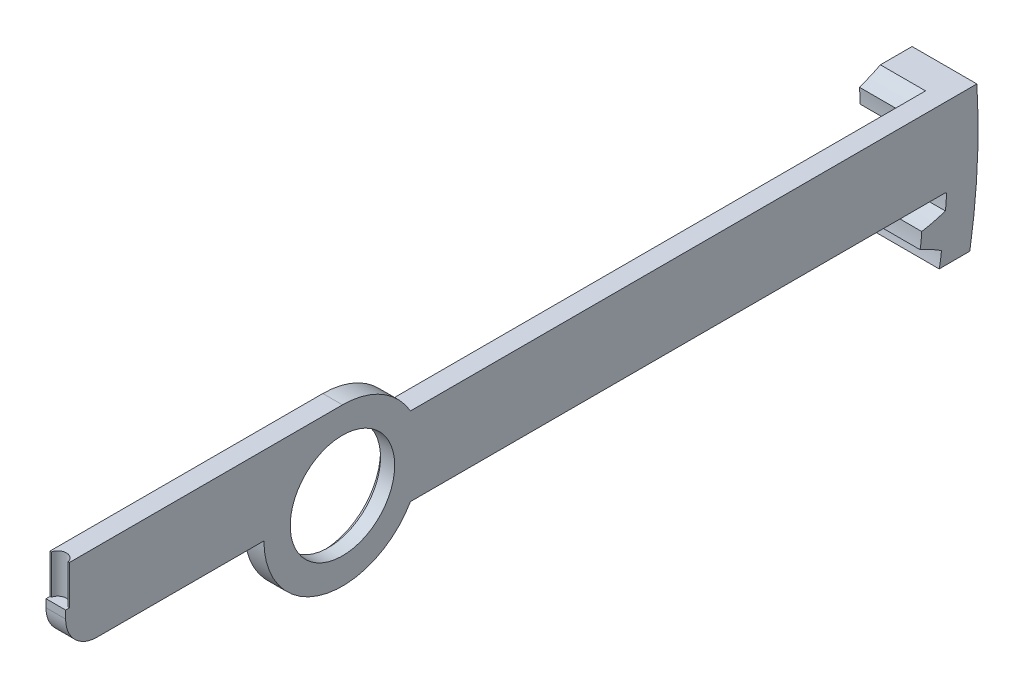
from build123d import *

# Parameters (mm, degrees)
SKETCH_1_R              = 6.65
EXTRUDE_1_DEPTH         = 1.25
EXTRUDE_2_DEPTH         = 1.25
EXTRUDE_2_DEPTH_BACK    = 7
SKETCH_3_R              = 1.1
CUT_EXTRUDE_1_DEPTH     = 5
CHAMFER_1_SIZE          = 0.7
CUT_EXTRUDE1_DEPTH      = 10
CUT_EXTRUDE1_DEPTH_BACK = 10
SKETCH1_W               = 17.169793681
SKETCH1_H               = 8.928336681


with BuildPart() as part:
    # Эскиз1 → Бобышка-Вытянуть1 (new, symmetric)
    with BuildSketch(Plane(origin=(0, 0, 0), x_dir=(0, 0, -1), z_dir=(1, 0, 0))):
        with BuildLine():
            Line((-31.25, 0), (-10, 0))
            ThreePointArc((-10, 0), (-2.588190451, -9.659258263), (8.660254038, -5))
            Line((8.660254038, -5), (76.721847542, -5))
            ThreePointArc((76.721847542, -5), (75.425886146, -4.389181279), (74.09117429, -3.868451302))
            ThreePointArc((74.09117429, -3.868451302), (74.147561595, -2.912548148), (74.149130868, -1.954984622))
            ThreePointArc((74.149130868, -1.954984622), (75.638846987, -1.51744657), (77.087831178, -0.959648686))
            ThreePointArc((77.087831178, -0.959648686), (77.109856091, -0.006099484), (77.083941958, 0.947351948))
            ThreePointArc((77.083941958, 0.947351948), (75.643750299, 1.505844774), (74.166291118, 1.956600379))
            ThreePointArc((74.166291118, 1.956600379), (74.147505302, 2.913980899), (74.073940169, 3.8687157))
            ThreePointArc((74.073940169, 3.8687157), (75.433826566, 4.383081961), (76.750365892, 5))
            Line((76.750365892, 5), (8.660254038, 5))
            ThreePointArc((8.660254038, 5), (5, 8.660254038), (0, 10))
            Line((0, 10), (-34.75, 10))
            Line((-34.75, 10), (-34.75, 5))
            Line((-34.75, 5), (-35.25, 5))
            Line((-35.25, 5), (-35.25, 4))
            ThreePointArc((-35.25, 4), (-34.078427125, 1.171572875), (-31.25, 0))
        make_face()
        Circle(SKETCH_1_R, mode=Mode.SUBTRACT)
    extrude(amount=EXTRUDE_1_DEPTH, both=True)

    # Эскиз1<5> → Бобышка-Вытянуть2 (add, two sides: drawn at the far end of the back side and taken through both)
    with BuildSketch(Plane(origin=(0, 0, 0), x_dir=(0, 0, -1), z_dir=(1, 0, 0)).offset(-EXTRUDE_2_DEPTH_BACK)):
        with BuildLine():
            Line((73.559260736, 9.685830974), (74.227172899, 10))
            Line((74.227172899, 10), (80.32185029, 10))
            ThreePointArc((80.32185029, 10), (80.927765714, -1.515378033), (79.891173693, -13))
            Line((79.891173693, -13), (75.988629927, -13.007027449))
            ThreePointArc((75.988629927, -13.007027449), (76.159551637, -12.068663477), (76.283109214, -11.12289675))
            ThreePointArc((76.283109214, -11.12289675), (74.948016231, -10.345984286), (73.559260736, -9.669652694))
            ThreePointArc((73.559260736, -9.669652694), (73.690473514, -8.721120367), (73.767167518, -7.766631814))
            ThreePointArc((73.767167518, -7.766631814), (75.28662018, -7.447324325), (76.774901953, -7.004931935))
            ThreePointArc((76.774901953, -7.004931935), (76.871673579, -6.056050262), (76.920646267, -5.103504803))
            ThreePointArc((76.920646267, -5.103504803), (75.528713081, -4.433737489), (74.09117429, -3.868451302))
            ThreePointArc((74.09117429, -3.868451302), (74.147561595, -2.912548148), (74.149130868, -1.954984622))
            ThreePointArc((74.149130868, -1.954984622), (75.638846987, -1.51744657), (77.087831178, -0.959648686))
            ThreePointArc((77.087831178, -0.959648686), (77.109856091, -0.006099484), (77.083941958, 0.947351948))
            ThreePointArc((77.083941958, 0.947351948), (75.643750299, 1.505844774), (74.166291118, 1.956600379))
            ThreePointArc((74.166291118, 1.956600379), (74.147505302, 2.913980899), (74.073940169, 3.8687157))
            ThreePointArc((74.073940169, 3.8687157), (75.524735151, 4.421786748), (76.925488289, 5.091551117))
            ThreePointArc((76.925488289, 5.091551117), (76.872630699, 6.043888899), (76.771989513, 6.992367959))
            ThreePointArc((76.771989513, 6.992367959), (75.292418643, 7.436143003), (73.784148097, 7.769588967))
            ThreePointArc((73.784148097, 7.769588967), (73.691130431, 8.729989779), (73.559260736, 9.685830974))
        make_face()
    extrude(amount=EXTRUDE_2_DEPTH + EXTRUDE_2_DEPTH_BACK)

    # Эскиз3 → Вырез-Вытянуть1 (cut)
    with BuildSketch(Plane(origin=(0, 10, 0), x_dir=(1, 0, 0), z_dir=(0, 1, 0))):
        with Locations((0, -35)):
            Circle(SKETCH_3_R)
    extrude(amount=-CUT_EXTRUDE_1_DEPTH, mode=Mode.SUBTRACT)

    # Фаска1
    chamfer_1_edges = [part.edges().sort_by_distance(p)[0] for p in [
        (-1.25, 0, 6.65),
    ]]
    chamfer(chamfer_1_edges, length=CHAMFER_1_SIZE)

    # Sketch1 → Cut-Extrude1 (cut, two sides: drawn at the far end of the back side and taken through both)
    with BuildSketch(Plane(origin=(0, 0, 0), x_dir=(0, 0, -1), z_dir=(1, 0, 0)).offset(-CUT_EXTRUDE1_DEPTH_BACK)):
        with Locations((77.607372566, 9.464168341)):
            Rectangle(SKETCH1_W, SKETCH1_H)
    extrude(amount=CUT_EXTRUDE1_DEPTH + CUT_EXTRUDE1_DEPTH_BACK, mode=Mode.SUBTRACT)


solid = part.part
